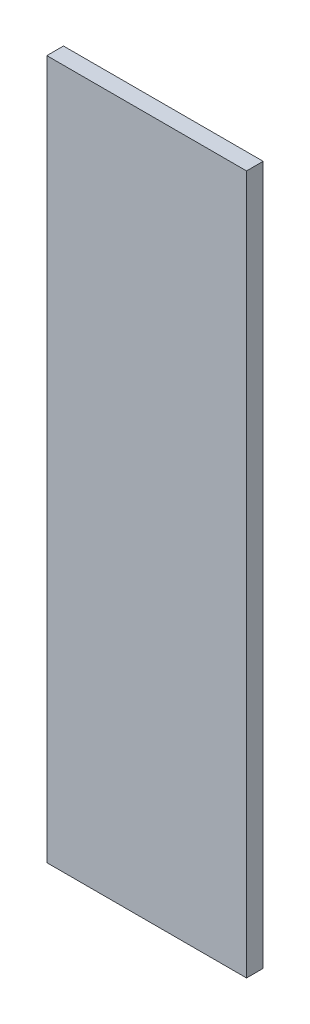
from build123d import *

# Parameters (mm, degrees)
SKETCH1_W           = 12
SKETCH1_H           = 42
BOSS_EXTRUDE1_DEPTH = 1


with BuildPart() as part:
    # Sketch1 → Boss-Extrude1 (new body)
    with BuildSketch(Plane.XY):
        Rectangle(SKETCH1_W, SKETCH1_H)
    extrude(amount=BOSS_EXTRUDE1_DEPTH)


solid = part.part
